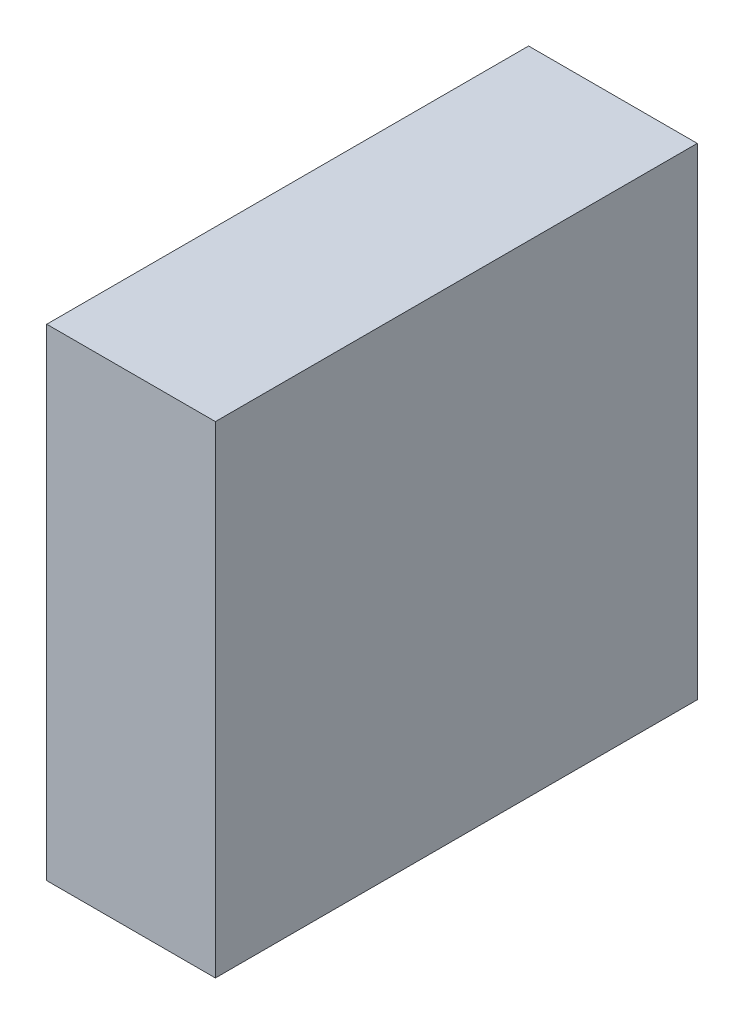
from build123d import *

# Parameters (mm, degrees)
SKETCH1_W           = 254
SKETCH1_H           = 254
BOSS_EXTRUDE1_DEPTH = 88.9


with BuildPart() as part:
    # Sketch1 → Boss-Extrude1 (new body)
    with BuildSketch(Plane(origin=(0, 0, 0), x_dir=(0, 0, -1), z_dir=(1, 0, 0))):
        with Locations((127, 127)):
            Rectangle(SKETCH1_W, SKETCH1_H)
    extrude(amount=BOSS_EXTRUDE1_DEPTH)


solid = part.part
